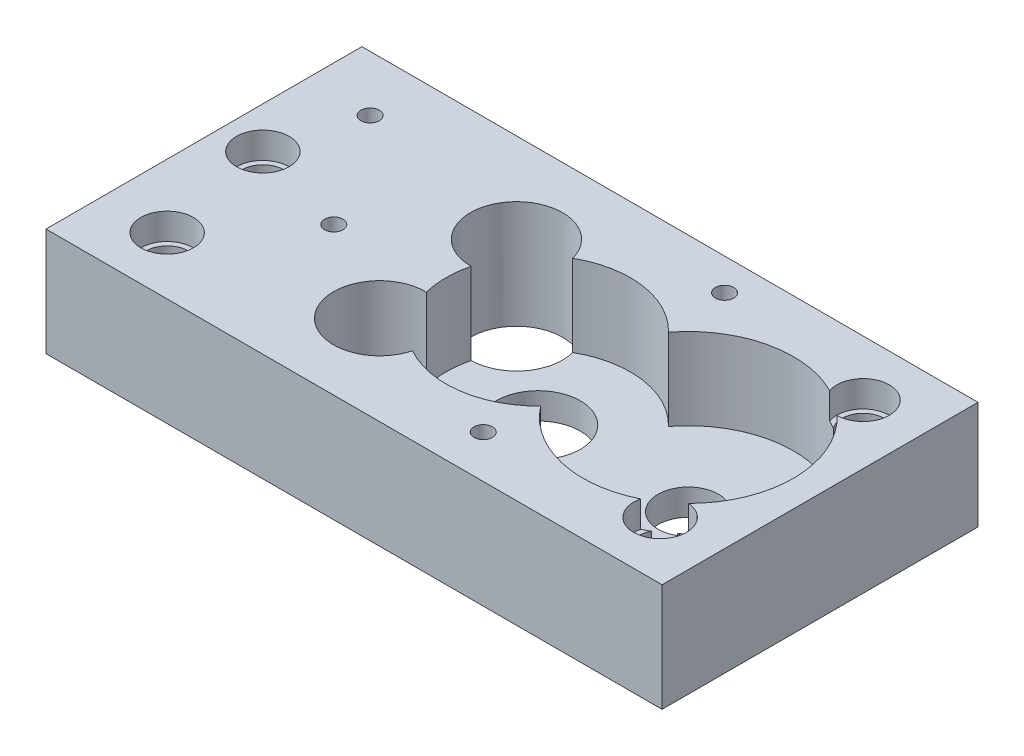
from build123d import *

# Parameters (mm, degrees)
SKETCH_1_W          = 23.4
SKETCH_1_H          = 12
SKETCH_1_R          = 1.75
SKETCH_1_R_2        = 1.6
SKETCH_1_R_3        = 1.15
EXTRUDE_1_DEPTH     = 1
EXTRUDE_START       = 1
SKETCH_1_4_W        = 23.4
SKETCH_1_4_H        = 12
EXTRUDE_2_DEPTH     = 3.1
SKETCH_3_R          = 0.35
CUT_EXTRUDE_3_DEPTH = 2
SKETCH_3_3_R        = 1
CUT_EXTRUDE_4_DEPTH = 1
SKETCH_3_4_R        = 0.8
CUT_EXTRUDE_5_DEPTH = 27.615221209


with BuildPart() as part:
    # 草图1 → 凸台-拉伸1 (new body)
    with BuildSketch(Plane(origin=(0, 0, 0), x_dir=(1, 0, 0), z_dir=(0, 1, 0))):
        with Locations((11.7, -6)):
            Rectangle(SKETCH_1_W, SKETCH_1_H)
        with Locations(Location((9.270831301, -3.4, 0), (0, 0, 270))):
            Circle(SKETCH_1_R, mode=Mode.SUBTRACT)
        with Locations(Location((9.270831301, -8.6, 0), (0, 0, 270))):
            Circle(SKETCH_1_R, mode=Mode.SUBTRACT)
        with Locations(Location((12.695740059, -6, 0), (0, 0, 270))):
            Circle(SKETCH_1_R_2, mode=Mode.SUBTRACT)
        with Locations(Location((18.395740059, -6, 0), (0, 0, 270))):
            Circle(SKETCH_1_R_3, mode=Mode.SUBTRACT)
    extrude(amount=EXTRUDE_1_DEPTH)

    # 草图1<4> → 凸台-拉伸2 (add)
    with BuildSketch(Plane(origin=(0, 0, 0), x_dir=(1, 0, 0), z_dir=(0, 1, 0)).offset(EXTRUDE_START)):
        with Locations((11.7, -6)):
            Rectangle(SKETCH_1_4_W, SKETCH_1_4_H)
        with BuildLine():
            ThreePointArc((9.300586178, -5.149747024), (7.876973085, -2.341860465), (10.964181547, -2.958338428))
            ThreePointArc((10.964181547, -2.958338428), (13.1957667, -2.53590223), (15.21679269, -3.572183362))
            ThreePointArc((15.21679269, -3.572183362), (19.67718661, -2.210818725), (22.395740059, -6))
            ThreePointArc((22.395740059, -6), (19.67718661, -9.789181275), (15.21679269, -8.427816638))
            ThreePointArc((15.21679269, -8.427816638), (13.1957667, -9.46409777), (10.964181547, -9.041661572))
            ThreePointArc((10.964181547, -9.041661572), (7.876973085, -9.658139535), (9.300586178, -6.850252976))
            ThreePointArc((9.300586178, -6.850252976), (9.195740059, -6), (9.300586178, -5.149747024))
        make_face(mode=Mode.SUBTRACT)
    extrude(amount=EXTRUDE_2_DEPTH)

    # 草图3 → 切除-拉伸3 (cut)
    with BuildSketch(Plane(origin=(0, 4.1, 0), x_dir=(1, 0, 0), z_dir=(0, 1, 0))):
        with Locations(Location((2.419185522, -2.108925173, 0), (0, 0, 270))):
            Circle(SKETCH_3_R)
        with Locations(Location((14.983521503, -1.209932246, 0), (0, 0, 270))):
            Circle(SKETCH_3_R)
        with Locations(Location((14.983521503, -10.376111281, 0), (0, 0, 270))):
            Circle(SKETCH_3_R)
        with Locations(Location((5.314681037, -6.384388153, 0), (0, 0, 270))):
            Circle(SKETCH_3_R)
    extrude(amount=-CUT_EXTRUDE_3_DEPTH, mode=Mode.SUBTRACT)

    # 草图3<3> → 切除-拉伸4 (cut)
    with BuildSketch(Plane(origin=(0, 4.1, 0), x_dir=(1, 0, 0), z_dir=(0, 1, 0))):
        with Locations(Location((1.568943185, -5.332489754, 0), (0, 0, 270))):
            Circle(SKETCH_3_3_R)
        with Locations(Location((2.419185522, -9.817518082, 0), (0, 0, 270))):
            Circle(SKETCH_3_3_R)
        with Locations((21.143175994, -2.108925173)):
            Circle(SKETCH_3_3_R)
        with Locations((21.143175994, -9.817518082)):
            Circle(SKETCH_3_3_R)
    extrude(amount=-CUT_EXTRUDE_4_DEPTH, mode=Mode.SUBTRACT)

    # 草图3<4> → 切除-拉伸5 (cut, through all)
    with BuildSketch(Plane(origin=(0, 4.1, 0), x_dir=(1, 0, 0), z_dir=(0, 1, 0))):
        with Locations(Location((1.568943185, -5.332489754, 0), (0, 0, 270))):
            Circle(SKETCH_3_4_R)
        with Locations(Location((21.143175994, -2.108925173, 0), (0, 0, 270))):
            Circle(SKETCH_3_4_R)
        with Locations(Location((2.419185522, -9.817518082, 0), (0, 0, 270))):
            Circle(SKETCH_3_4_R)
        with Locations(Location((21.143175994, -9.817518082, 0), (0, 0, 270))):
            Circle(SKETCH_3_4_R)
    extrude(amount=-CUT_EXTRUDE_5_DEPTH, mode=Mode.SUBTRACT)


solid = part.part
